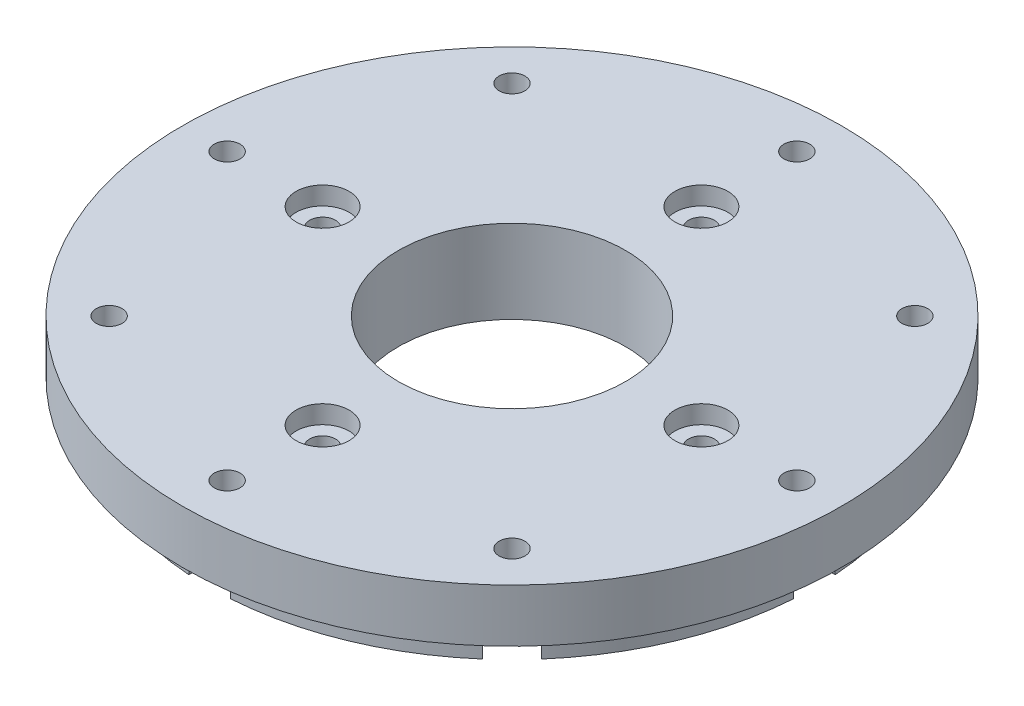
from build123d import *

# Parameters (mm, degrees)
CROQUIS1_R                                           = 40
CROQUIS1_R_2                                         = 15
SALIENTE_EXTRUIR1_DEPTH                              = 2
CROQUIS2_R                                           = 43.5
CROQUIS2_R_2                                         = 15
SALIENTE_EXTRUIR2_DEPTH                              = 7
TALADRO_DE_MARGEN_PARA_M31_D                         = 3.4
TALADRO_DE_MARGEN_PARA_M31_DEPTH                     = 20
TALADRO_DE_MARGEN_PARA_M31_TIP                       = 1.021463052
CORTAR_EXTRUIR1_START                                = -7
CORTAR_EXTRUIR1_DEPTH                                = 7
REFRENTADO_PARA_TORNILLO_CON_CABEZA_TRON_D           = 3.4
REFRENTADO_PARA_TORNILLO_CON_CABEZA_TRON_DEPTH       = 20
REFRENTADO_PARA_TORNILLO_CON_CABEZA_TRON_CBORE_D     = 7
REFRENTADO_PARA_TORNILLO_CON_CABEZA_TRON_CBORE_DEPTH = 2.4
REFRENTADO_PARA_TORNILLO_CON_CABEZA_TRON_TIP         = 1.021463052


with BuildPart() as part:
    # Croquis1 → Saliente-Extruir1 (new, symmetric)
    with BuildSketch(Plane(origin=(0, 0, 0), x_dir=(1, 0, 0), z_dir=(0, 1, 0))):
        with Locations(Location((0, 0, 0), (0, 0, 270))):
            Circle(CROQUIS1_R)
        with Locations(Location((0, 0, 0), (0, 0, 270))):
            Circle(CROQUIS1_R_2, mode=Mode.SUBTRACT)
    extrude(amount=SALIENTE_EXTRUIR1_DEPTH, both=True)

    # Croquis2 → Saliente-Extruir2 (add)
    with BuildSketch(Plane(origin=(0, 2, 0), x_dir=(1, 0, 0), z_dir=(0, 1, 0))):
        with Locations(Location((0, 0, 0), (0, 0, 270))):
            Circle(CROQUIS2_R)
        with Locations(Location((0, 0, 0), (0, 0, 270))):
            Circle(CROQUIS2_R_2, mode=Mode.SUBTRACT)
    extrude(amount=SALIENTE_EXTRUIR2_DEPTH)

    # Taladro de margen para M31
    with Locations(Plane(origin=(0, 9, 0), x_dir=(1, 0, 0), z_dir=(0, 1, 0))):
        with Locations((0, 37.6), (26.587214973, 26.587214973), (37.6, 0), (26.587214973, -26.587214973), (0, -37.6), (-26.587214973, -26.587214973), (-37.6, 0), (-26.587214973, 26.587214973)):
            Hole(TALADRO_DE_MARGEN_PARA_M31_D / 2, depth=TALADRO_DE_MARGEN_PARA_M31_DEPTH)
            with Locations((0, 0, -(TALADRO_DE_MARGEN_PARA_M31_DEPTH + TALADRO_DE_MARGEN_PARA_M31_TIP / 2))):  # 118° drill point
                Cone(0, TALADRO_DE_MARGEN_PARA_M31_D / 2, TALADRO_DE_MARGEN_PARA_M31_TIP, mode=Mode.SUBTRACT)

    # Croquis5 → Cortar-Extruir1 (cut)
    with BuildSketch(Plane.XZ.offset(2).offset(CORTAR_EXTRUIR1_START)):
        with BuildLine():
            Line((-2.753960784, 39.19), (-2.753960784, 36.01))
            Line((-2.753960784, 36.01), (0, 34.42))
            Line((0, 34.42), (2.753960784, 36.01))
            Line((2.753960784, 36.01), (2.753960784, 39.19))
            Line((2.753960784, 39.19), (2.753960784, 39.905083636))
            ThreePointArc((2.753960784, 39.905083636), (2.073794244, 39.946206046), (1.393025891, 39.975736127))
            Line((1.393025891, 39.975736127), (0, 40.78))
            Line((0, 40.78), (-1.393025891, 39.975736127))
            ThreePointArc((-1.393025891, 39.975736127), (-2.073794244, 39.946206046), (-2.753960784, 39.905083636))
            Line((-2.753960784, 39.905083636), (-2.753960784, 39.19))
        make_face()
        with BuildLine():
            Line((25.764170409, 29.6588591), (23.515570845, 27.410259536))
            Line((23.515570845, 27.410259536), (24.338615408, 24.338615408))
            Line((24.338615408, 24.338615408), (27.410259536, 23.515570845))
            Line((27.410259536, 23.515570845), (29.6588591, 25.764170409))
            Line((29.6588591, 25.764170409), (30.164499588, 26.269810897))
            ThreePointArc((30.164499588, 26.269810897), (29.71262715, 26.779839205), (29.252132152, 27.282096044))
            Line((29.252132152, 27.282096044), (28.835814537, 28.835814537))
            Line((28.835814537, 28.835814537), (27.282096044, 29.252132152))
            ThreePointArc((27.282096044, 29.252132152), (26.779839205, 29.71262715), (26.269810897, 30.164499588))
            Line((26.269810897, 30.164499588), (25.764170409, 29.6588591))
        make_face()
        with BuildLine():
            Line((39.19, 2.753960784), (36.01, 2.753960784))
            Line((36.01, 2.753960784), (34.42, 0))
            Line((34.42, 0), (36.01, -2.753960784))
            Line((36.01, -2.753960784), (39.19, -2.753960784))
            Line((39.19, -2.753960784), (39.905083636, -2.753960784))
            ThreePointArc((39.905083636, -2.753960784), (39.946206046, -2.073794244), (39.975736127, -1.393025891))
            Line((39.975736127, -1.393025891), (40.78, 0))
            Line((40.78, 0), (39.975736127, 1.393025891))
            ThreePointArc((39.975736127, 1.393025891), (39.946206046, 2.073794244), (39.905083636, 2.753960784))
            Line((39.905083636, 2.753960784), (39.19, 2.753960784))
        make_face()
        with BuildLine():
            Line((29.6588591, -25.764170409), (27.410259536, -23.515570845))
            Line((27.410259536, -23.515570845), (24.338615408, -24.338615408))
            Line((24.338615408, -24.338615408), (23.515570845, -27.410259536))
            Line((23.515570845, -27.410259536), (25.764170409, -29.6588591))
            Line((25.764170409, -29.6588591), (26.269810897, -30.164499588))
            ThreePointArc((26.269810897, -30.164499588), (26.779839205, -29.71262715), (27.282096044, -29.252132152))
            Line((27.282096044, -29.252132152), (28.835814537, -28.835814537))
            Line((28.835814537, -28.835814537), (29.252132152, -27.282096044))
            ThreePointArc((29.252132152, -27.282096044), (29.71262715, -26.779839205), (30.164499588, -26.269810897))
            Line((30.164499588, -26.269810897), (29.6588591, -25.764170409))
        make_face()
        with BuildLine():
            Line((2.753960784, -39.19), (2.753960784, -36.01))
            Line((2.753960784, -36.01), (0, -34.42))
            Line((0, -34.42), (-2.753960784, -36.01))
            Line((-2.753960784, -36.01), (-2.753960784, -39.19))
            Line((-2.753960784, -39.19), (-2.753960784, -39.905083636))
            ThreePointArc((-2.753960784, -39.905083636), (-2.073794244, -39.946206046), (-1.393025891, -39.975736127))
            Line((-1.393025891, -39.975736127), (0, -40.78))
            Line((0, -40.78), (1.393025891, -39.975736127))
            ThreePointArc((1.393025891, -39.975736127), (2.073794244, -39.946206046), (2.753960784, -39.905083636))
            Line((2.753960784, -39.905083636), (2.753960784, -39.19))
        make_face()
        with BuildLine():
            Line((-25.764170409, -29.6588591), (-23.515570845, -27.410259536))
            Line((-23.515570845, -27.410259536), (-24.338615408, -24.338615408))
            Line((-24.338615408, -24.338615408), (-27.410259536, -23.515570845))
            Line((-27.410259536, -23.515570845), (-29.6588591, -25.764170409))
            Line((-29.6588591, -25.764170409), (-30.164499588, -26.269810897))
            ThreePointArc((-30.164499588, -26.269810897), (-29.71262715, -26.779839205), (-29.252132152, -27.282096044))
            Line((-29.252132152, -27.282096044), (-28.835814537, -28.835814537))
            Line((-28.835814537, -28.835814537), (-27.282096044, -29.252132152))
            ThreePointArc((-27.282096044, -29.252132152), (-26.779839205, -29.71262715), (-26.269810897, -30.164499588))
            Line((-26.269810897, -30.164499588), (-25.764170409, -29.6588591))
        make_face()
        with BuildLine():
            Line((-39.19, -2.753960784), (-36.01, -2.753960784))
            Line((-36.01, -2.753960784), (-34.42, 0))
            Line((-34.42, 0), (-36.01, 2.753960784))
            Line((-36.01, 2.753960784), (-39.19, 2.753960784))
            Line((-39.19, 2.753960784), (-39.905083636, 2.753960784))
            ThreePointArc((-39.905083636, 2.753960784), (-39.946206046, 2.073794244), (-39.975736127, 1.393025891))
            Line((-39.975736127, 1.393025891), (-40.78, 0))
            Line((-40.78, 0), (-39.975736127, -1.393025891))
            ThreePointArc((-39.975736127, -1.393025891), (-39.946206046, -2.073794244), (-39.905083636, -2.753960784))
            Line((-39.905083636, -2.753960784), (-39.19, -2.753960784))
        make_face()
        with BuildLine():
            Line((-29.6588591, 25.764170409), (-27.410259536, 23.515570845))
            Line((-27.410259536, 23.515570845), (-24.338615408, 24.338615408))
            Line((-24.338615408, 24.338615408), (-23.515570845, 27.410259536))
            Line((-23.515570845, 27.410259536), (-25.764170409, 29.6588591))
            Line((-25.764170409, 29.6588591), (-26.269810897, 30.164499588))
            ThreePointArc((-26.269810897, 30.164499588), (-26.779839205, 29.71262715), (-27.282096044, 29.252132152))
            Line((-27.282096044, 29.252132152), (-28.835814537, 28.835814537))
            Line((-28.835814537, 28.835814537), (-29.252132152, 27.282096044))
            ThreePointArc((-29.252132152, 27.282096044), (-29.71262715, 26.779839205), (-30.164499588, 26.269810897))
            Line((-30.164499588, 26.269810897), (-29.6588591, 25.764170409))
        make_face()
    extrude(amount=CORTAR_EXTRUIR1_DEPTH, mode=Mode.SUBTRACT)

    # Refrentado para tornillo con cabeza troncocónica de M32
    with Locations(Plane(origin=(0, 9, 0), x_dir=(1, 0, 0), z_dir=(0, 1, 0))):
        with Locations((0, 25), (25, 0), (0, -25), (-25, 0)):
            CounterBoreHole(REFRENTADO_PARA_TORNILLO_CON_CABEZA_TRON_D / 2, REFRENTADO_PARA_TORNILLO_CON_CABEZA_TRON_CBORE_D / 2, REFRENTADO_PARA_TORNILLO_CON_CABEZA_TRON_CBORE_DEPTH, depth=REFRENTADO_PARA_TORNILLO_CON_CABEZA_TRON_DEPTH)
            with Locations((0, 0, -(REFRENTADO_PARA_TORNILLO_CON_CABEZA_TRON_DEPTH + REFRENTADO_PARA_TORNILLO_CON_CABEZA_TRON_TIP / 2))):  # 118° drill point
                Cone(0, REFRENTADO_PARA_TORNILLO_CON_CABEZA_TRON_D / 2, REFRENTADO_PARA_TORNILLO_CON_CABEZA_TRON_TIP, mode=Mode.SUBTRACT)


solid = part.part
